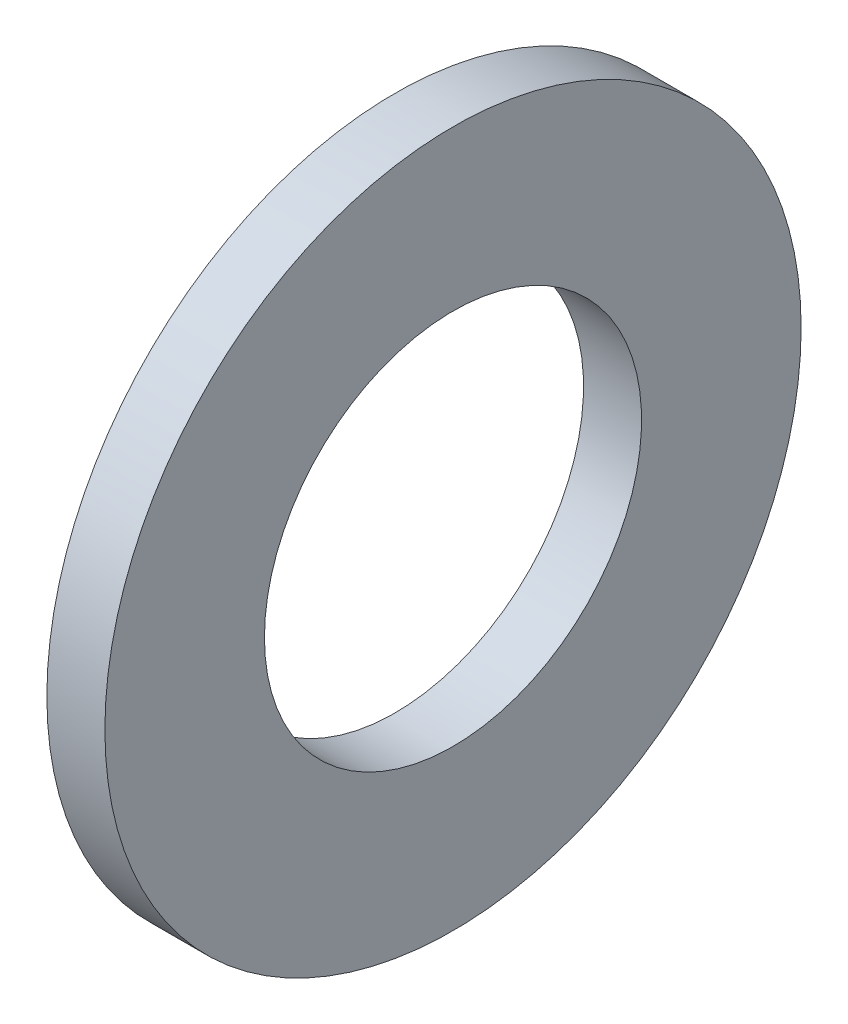
from build123d import *

# Parameters (mm, degrees)
SKETCH1_W = 2
SKETCH1_H = 5.5


with BuildPart() as part:
    # Sketch1 → Base-Revolve (revolve)
    with BuildSketch(Plane.XY, mode=Mode.PRIVATE) as base_revolve_sk:
        with Locations((-1, 9.25)):
            Rectangle(SKETCH1_W, SKETCH1_H)
    revolve(base_revolve_sk.sketch.rotate(Axis((-34.925, 0, 0), (1, 0, 0)), 90), axis=Axis((-34.925, 0, 0), (1, 0, 0)))


solid = part.part
